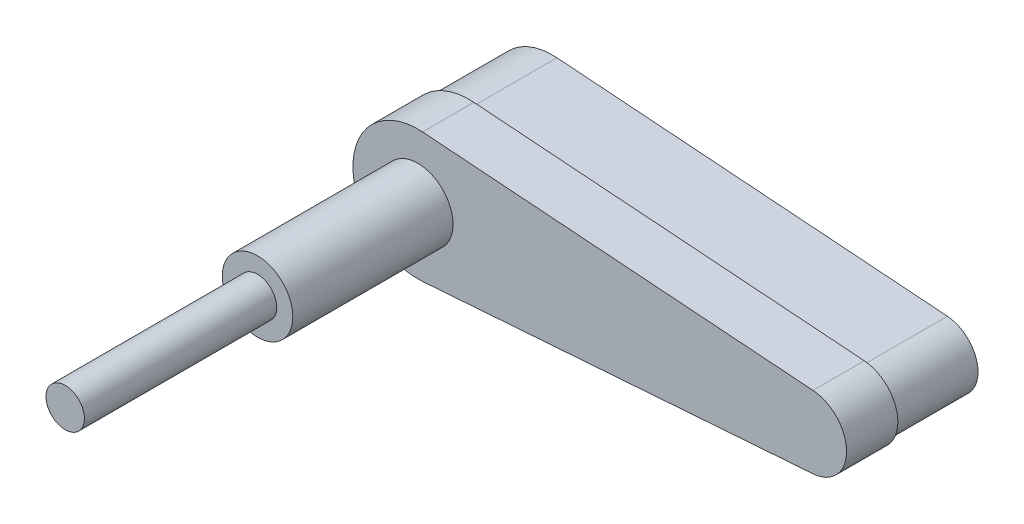
from build123d import *

# Parameters (mm, degrees)
BOSS_EXTRU_1_DEPTH      = 13
BOSS_EXTRU_2_DEPTH      = 8
ESQUISSE4_R             = 5.5
BOSS_EXTRU_3_DEPTH      = 55
ENL_V_START             = -30
ESQUISSE5_R             = 5.5
ESQUISSE5_R_2           = 3
ENL_V_MAT_EXTRU_1_DEPTH = 30


with BuildPart() as part:
    # Esquisse1 → Boss.-Extru.1 (new body)
    with BuildSketch(Plane.XY):
        with BuildLine():
            Line((10.329521935, 9.6), (71.2270063, 5.135702408))
            ThreePointArc((71.2270063, 5.135702408), (76, 0), (71.2270063, -5.135702408))
            Line((71.2270063, -5.135702408), (10.329521935, -9.6))
            ThreePointArc((10.329521935, -9.6), (0, 0), (10.329521935, 9.6))
        make_face()
    extrude(amount=BOSS_EXTRU_1_DEPTH)

    # Esquisse3 → Boss.-Extru.2 (add)
    with BuildSketch(Plane.XY.offset(13)):
        with BuildLine():
            Line((71.263562407, 5.634364269), (10.366078041, 10.09866186))
            ThreePointArc((10.366078041, 10.09866186), (-0.5, 0), (10.366078041, -10.09866186))
            Line((10.366078041, -10.09866186), (71.263562407, -5.634364269))
            ThreePointArc((71.263562407, -5.634364269), (76.5, 0), (71.263562407, 5.634364269))
        make_face()
    extrude(amount=BOSS_EXTRU_2_DEPTH)

    # Esquisse4 → Boss.-Extru.3 (add)
    with BuildSketch(Plane.XY.offset(21)):
        with Locations((9.625761224, 0)):
            Circle(ESQUISSE4_R)
    extrude(amount=BOSS_EXTRU_3_DEPTH)

    # Esquisse5 → Enlèv. mat.-Extru.1 (cut)
    with BuildSketch(Plane.XY.offset(76).offset(ENL_V_START)):
        with Locations((9.625761224, 0)):
            Circle(ESQUISSE5_R)
        with Locations((9.625761224, 0)):
            Circle(ESQUISSE5_R_2, mode=Mode.SUBTRACT)
    extrude(amount=ENL_V_MAT_EXTRU_1_DEPTH, mode=Mode.SUBTRACT)


solid = part.part
